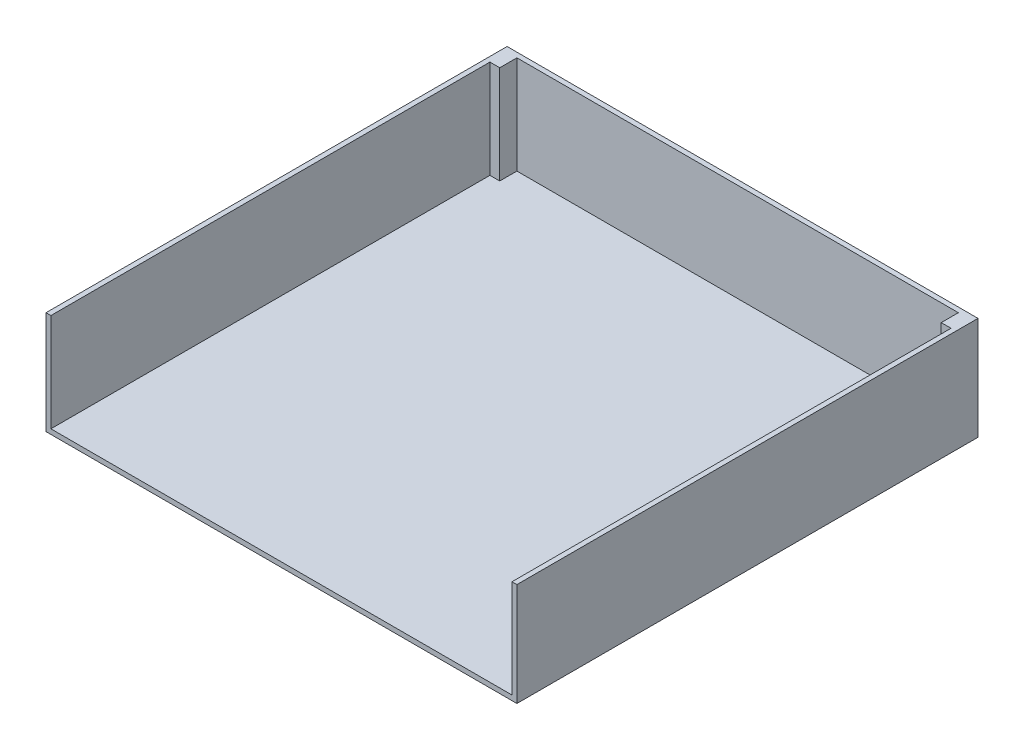
from build123d import *

# Parameters (mm, degrees)
BOSS_EXTRUDE1_DEPTH = 254
SKETCH2_W           = 1219.2
SKETCH2_H           = 1193.8
BOSS_EXTRUDE2_DEPTH = 12.7
SKETCH3_W           = 25.4
SKETCH3_H           = 44.45
BOSS_EXTRUDE3_DEPTH = 254


with BuildPart() as part:
    # Sketch1 → Boss-Extrude1 (new body)
    with BuildSketch(Plane(origin=(0, 0, 0), x_dir=(1, 0, 0), z_dir=(0, 1, 0))):
        Polygon((-596.9, -584.2), (-596.9, 584.2), (596.9, 584.2), (596.9, -584.2), (596.9, -596.9), (609.6, -596.9), (609.6, 596.9), (-609.6, 596.9), (-609.6, -596.9), (-596.9, -596.9), align=None)
    extrude(amount=BOSS_EXTRUDE1_DEPTH)

    # Sketch2 → Boss-Extrude2 (add)
    with BuildSketch(Plane.XZ):
        Rectangle(SKETCH2_W, SKETCH2_H)
    extrude(amount=BOSS_EXTRUDE2_DEPTH)

    # Sketch3 → Boss-Extrude3 (add)
    with BuildSketch(Plane(origin=(0, 0, 0), x_dir=(1, 0, 0), z_dir=(0, 1, 0))):
        with Locations((-584.2, 561.975)):
            Rectangle(SKETCH3_W, SKETCH3_H)
        with Locations((584.2, 561.975)):
            Rectangle(SKETCH3_W, SKETCH3_H)
    extrude(amount=BOSS_EXTRUDE3_DEPTH)


solid = part.part
